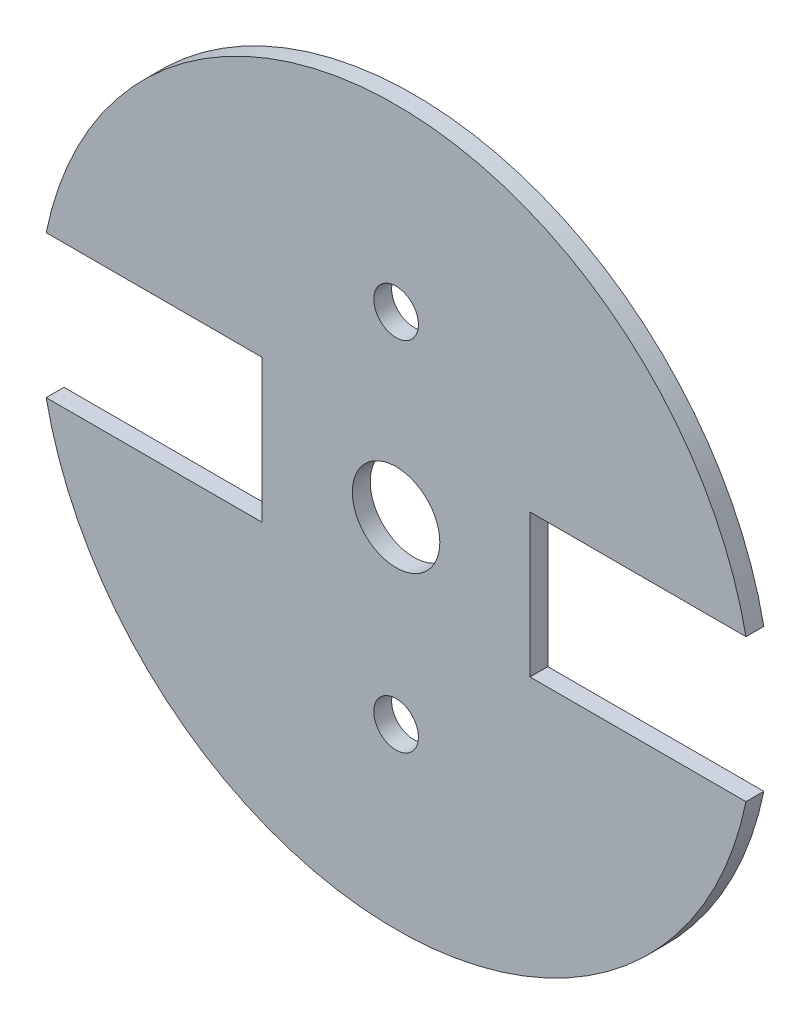
from build123d import *

# Parameters (mm, degrees)
SKETCH1_R           = 2.5
SKETCH1_R_2         = 4.9
BOSS_EXTRUDE1_DEPTH = 2


with BuildPart() as part:
    # Sketch1 → Boss-Extrude1 (new body)
    with BuildSketch(Plane.XY):
        with BuildLine():
            Line((-15, 8), (-39.191835885, 8))
            ThreePointArc((-39.191835885, 8), (0, 40), (39.191835885, 8))
            Line((39.191835885, 8), (15, 8))
            Line((15, 8), (15, -8))
            Line((15, -8), (39.191835885, -8))
            ThreePointArc((39.191835885, -8), (0, -40), (-39.191835885, -8))
            Line((-39.191835885, -8), (-15, -8))
            Line((-15, -8), (-15, 8))
        make_face()
        with Locations((0, 19.908720325)):
            Circle(SKETCH1_R, mode=Mode.SUBTRACT)
        with Locations((0, -20.091279675)):
            Circle(SKETCH1_R, mode=Mode.SUBTRACT)
        Circle(SKETCH1_R_2, mode=Mode.SUBTRACT)
    extrude(amount=BOSS_EXTRUDE1_DEPTH)


solid = part.part
